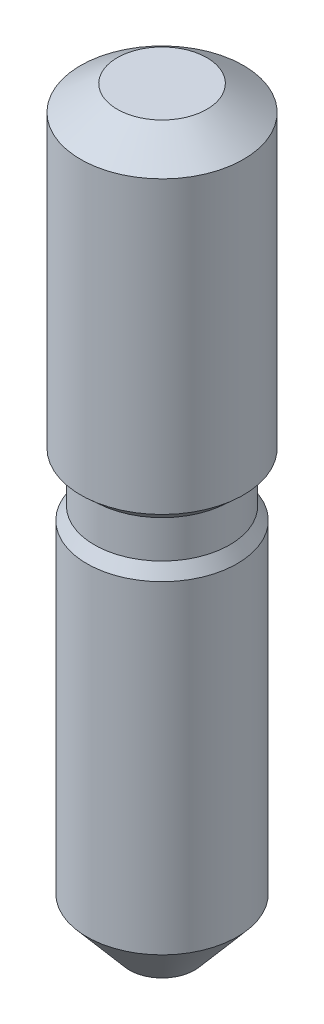
from build123d import *


with BuildPart() as part:
    # Sketch1 → Motor_reductora_husillo (revolve)
    with BuildSketch(Plane.XY, mode=Mode.PRIVATE) as motor_reductora_husillo_sk:
        Polygon((0, 0), (3.575, 0), (6.5, -2), (6.5, -25.2), (5.4, -26.2), (5.4, -29.2), (6, -30.2), (6, -56), (2.6, -60), (0, -60), align=None)
    revolve(motor_reductora_husillo_sk.sketch.rotate(Axis((0, -64, 0), (0, 1, 0)), 90), axis=Axis((0, -64, 0), (0, 1, 0)))


solid = part.part
